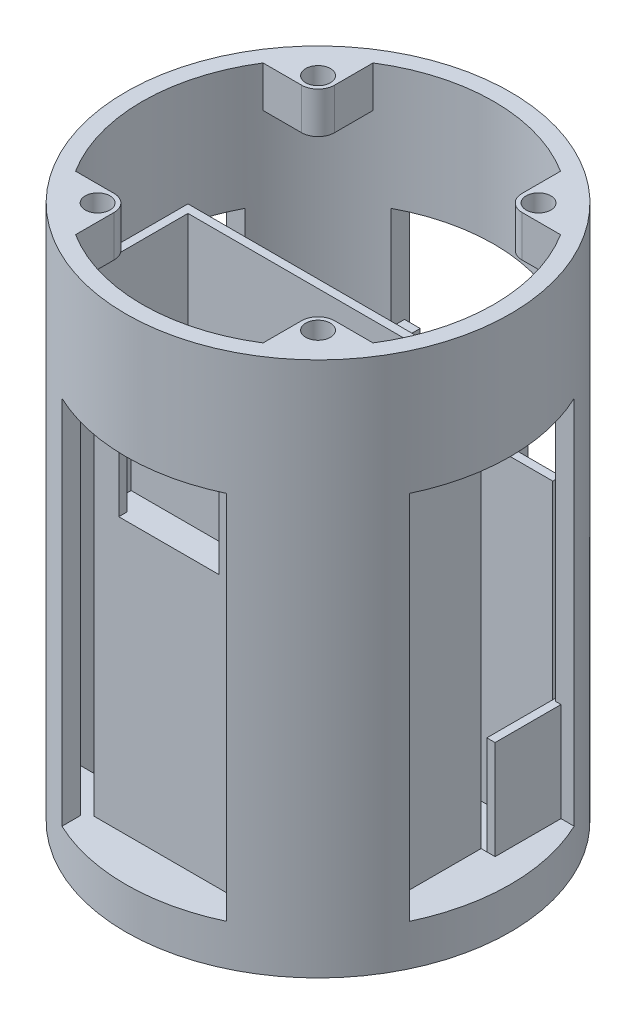
from build123d import *

# Parameters (mm, degrees)
ESQUISSE1_R                  = 23.35
BOSS_EXTRU_1_DEPTH           = 5
ESQUISSE2_W                  = 37
ESQUISSE2_H                  = 8
ESQUISSE2_W_2                = 33.6
ESQUISSE2_H_2                = 14.6
ENL_V_MAT_EXTRU_4_DEPTH      = 3
ESQUISSE10_R                 = 23.35
BOSS_EXTRU_2_DEPTH           = 60
ENL_V_MAT_EXTRU_5_DEPTH      = 73.90709842
ENL_V_MAT_EXTRU_5_DEPTH_BACK = 73.90709842
ESQUISSE11_W                 = 20
ESQUISSE11_H                 = 45
ENL_V_MAT_EXTRU_6_DEPTH      = 73.90709842
ENL_V_MAT_EXTRU_6_DEPTH_BACK = 73.90709842
ESQUISSE12_W                 = 20
ESQUISSE12_H                 = 45
ESQUISSE13_W                 = 18.2
ESQUISSE13_H                 = 4.5
ESQUISSE13_W_2               = 16.2
ESQUISSE13_H_2               = 2.5
BOSS_EXTRU_4_DEPTH           = 50
ENL_V_MAT_EXTRU_7_DEPTH      = 65.151734193
ENL_V_MAT_EXTRU_7_DEPTH_BACK = 17
ESQUISSE16_W                 = 15
ESQUISSE16_H                 = 5
BOSS_EXTRU_5_DEPTH           = 20
BOSS_EXTRU_6_DEPTH           = 15
BOSS_EXTRU_7_START           = -5
ESQUISSE18_R                 = 1.5
BOSS_EXTRU_7_DEPTH           = 5
BOSS_EXTRU_8_DEPTH           = 12
BOSS_EXTRU_9_DEPTH           = 23


with BuildPart() as part:
    # Esquisse1 → Boss.-Extru.1 (new body)
    with BuildSketch(Plane(origin=(0, 0, 0), x_dir=(1, 0, 0), z_dir=(0, 1, 0))):
        with Locations(Location((0, 0, 0), (0, 0, 270))):
            Circle(ESQUISSE1_R)
    extrude(amount=BOSS_EXTRU_1_DEPTH)

    # Esquisse2 → Enlèv. mat.-Extru.4 (cut)
    with BuildSketch(Plane(origin=(0, 5, 0), x_dir=(1, 0, 0), z_dir=(0, 1, 0))):
        with Locations((0, 6)):
            Rectangle(ESQUISSE2_W, ESQUISSE2_H)
        with Locations((0, -6.3)):
            Rectangle(ESQUISSE2_W_2, ESQUISSE2_H_2)
    extrude(amount=-ENL_V_MAT_EXTRU_4_DEPTH, mode=Mode.SUBTRACT)

    # Esquisse10 → Boss.-Extru.2 (add)
    with BuildSketch(Plane(origin=(0, 5, 0), x_dir=(1, 0, 0), z_dir=(0, 1, 0))):
        with Locations(Location((0, 0, 0), (0, 0, 270))):
            Circle(ESQUISSE10_R)
        with BuildLine():
            ThreePointArc((-16.8, -13.175071157), (-6.969307713, 20.180467041), (21.35, 0))
            ThreePointArc((21.35, 0), (20.180467041, -6.969307713), (16.8, -13.175071157))
            Line((16.8, -13.175071157), (16.8, -13.6))
            Line((16.8, -13.6), (16.457900838, -13.6))
            ThreePointArc((16.457900838, -13.6), (0, -21.35), (-16.457900838, -13.6))
            Line((-16.457900838, -13.6), (-16.8, -13.6))
            Line((-16.8, -13.6), (-16.8, -13.175071157))
        make_face(mode=Mode.SUBTRACT)
    extrude(amount=BOSS_EXTRU_2_DEPTH)

    # Esquisse11 → Enlèv. mat.-Extru.5 (cut, two sides: drawn at the far end of the back side and taken through both)
    with BuildSketch(Plane.XY.offset(-ENL_V_MAT_EXTRU_5_DEPTH_BACK)):
        with Locations((0, 27.5)):
            Rectangle(ESQUISSE11_W, ESQUISSE11_H)
    extrude(amount=ENL_V_MAT_EXTRU_5_DEPTH + ENL_V_MAT_EXTRU_5_DEPTH_BACK, mode=Mode.SUBTRACT)

    # Esquisse12 → Enlèv. mat.-Extru.6 (cut, two sides: drawn at the far end of the back side and taken through both)
    with BuildSketch(Plane(origin=(0, 0, 0), x_dir=(0, 0, -1), z_dir=(1, 0, 0)).offset(-ENL_V_MAT_EXTRU_6_DEPTH_BACK)):
        with Locations((0, 27.5)):
            Rectangle(ESQUISSE12_W, ESQUISSE12_H)
    extrude(amount=ENL_V_MAT_EXTRU_6_DEPTH + ENL_V_MAT_EXTRU_6_DEPTH_BACK, mode=Mode.SUBTRACT)

    # Esquisse13 → Boss.-Extru.4 (add)
    # profile 1 of 3: a face of its own
    with BuildSketch(Plane(origin=(0, 5, 0), x_dir=(1, 0, 0), z_dir=(0, 1, 0))):
        with BuildLine():
            Line((17.8, 2), (-17.8, 2))
            Line((-17.8, 2), (-17.8, -11.789083934))
            ThreePointArc((-17.8, -11.789083934), (-17.31387421, -12.49208789), (-16.8, -13.175071157))
            Line((-16.8, -13.175071157), (-16.8, 1))
            Line((-16.8, 1), (16.8, 1))
            Line((16.8, 1), (16.8, -13.175071157))
            ThreePointArc((16.8, -13.175071157), (17.31387421, -12.49208789), (17.8, -11.789083934))
            Line((17.8, -11.789083934), (17.8, 2))
        make_face()
    # profile 2 of 3: a face of its own
    with BuildSketch(Plane(origin=(0, 5, 0), x_dir=(1, 0, 0), z_dir=(0, 1, 0))):
        with Locations((0, -15.85)):
            Rectangle(ESQUISSE13_W, ESQUISSE13_H)
        with Locations((0, -15.85)):
            Rectangle(ESQUISSE13_W_2, ESQUISSE13_H_2, mode=Mode.SUBTRACT)
    # profile 3 of 3: a face of its own
    with BuildSketch(Plane(origin=(0, 5, 0), x_dir=(1, 0, 0), z_dir=(0, 1, 0))):
        with Locations((0, -15.85)):
            Rectangle(ESQUISSE13_W_2, ESQUISSE13_H_2)
    extrude(amount=BOSS_EXTRU_4_DEPTH)

    # Esquisse15 → Enlèv. mat.-Extru.7 (cut, two sides: drawn at the far end of the back side and taken through both)
    with BuildSketch(Plane(origin=(0, 55, 0), x_dir=(1, 0, 0), z_dir=(0, 1, 0)).offset(-ENL_V_MAT_EXTRU_7_DEPTH_BACK)):
        Polygon((8.1, -14.6), (-8.1, -14.6), (-8.1, -17.1), (-6.1, -17.1), (-6.1, -18.1), (6.1, -18.1), (6.1, -17.1), (8.1, -17.1), align=None)
    extrude(amount=ENL_V_MAT_EXTRU_7_DEPTH + ENL_V_MAT_EXTRU_7_DEPTH_BACK, mode=Mode.SUBTRACT)

    # Esquisse16 → Boss.-Extru.5 (add)
    with BuildSketch(Plane(origin=(0, 5, 0), x_dir=(1, 0, 0), z_dir=(0, 1, 0))):
        with Locations((0, 15.5)):
            Rectangle(ESQUISSE16_W, ESQUISSE16_H)
    extrude(amount=BOSS_EXTRU_5_DEPTH)

    # Esquisse17 → Boss.-Extru.6 (add)
    with BuildSketch(Plane(origin=(0, 25, 0), x_dir=(1, 0, 0), z_dir=(0, 1, 0))):
        Polygon((7.5, 18), (-0.6, 18), (-0.6, 17), (5.6, 17), (5.6, 14), (-5.6, 14), (-5.6, 16.758406292), (-5.6, 18), (-7.5, 18), (-7.5, 13), (7.5, 13), align=None)
    extrude(amount=BOSS_EXTRU_6_DEPTH)

    # Esquisse18 → Boss.-Extru.7 (add)
    # profile 1 of 4: a face of its own
    with BuildSketch(Plane(origin=(0, 65, 0), x_dir=(1, 0, 0), z_dir=(0, 1, 0)).offset(BOSS_EXTRU_7_START)):
        with BuildLine():
            Line((-11.385882097, 13.385882097), (-11.385882097, 20.385882097))
            ThreePointArc((-11.385882097, 20.385882097), (-16.510943341, 16.510943341), (-20.385882097, 11.385882097))
            Line((-20.385882097, 11.385882097), (-13.385882097, 11.385882097))
            ThreePointArc((-13.385882097, 11.385882097), (-11.971668535, 11.971668535), (-11.385882097, 13.385882097))
        make_face()
        with Locations(Location((-13.385882097, 13.385882097, 0), (0, 0, 270))):
            Circle(ESQUISSE18_R, mode=Mode.SUBTRACT)
    # profile 2 of 4: a face of its own
    with BuildSketch(Plane(origin=(0, 65, 0), x_dir=(1, 0, 0), z_dir=(0, 1, 0)).offset(BOSS_EXTRU_7_START)):
        with BuildLine():
            ThreePointArc((20.385882097, 11.385882097), (16.510943341, 16.510943341), (11.385882097, 20.385882097))
            Line((11.385882097, 20.385882097), (11.385882097, 13.385882097))
            ThreePointArc((11.385882097, 13.385882097), (11.971668535, 11.971668535), (13.385882097, 11.385882097))
            Line((13.385882097, 11.385882097), (20.385882097, 11.385882097))
        make_face()
        with Locations(Location((13.385882097, 13.385882097, 0), (0, 0, 270))):
            Circle(ESQUISSE18_R, mode=Mode.SUBTRACT)
    # profile 3 of 4: a face of its own
    with BuildSketch(Plane(origin=(0, 65, 0), x_dir=(1, 0, 0), z_dir=(0, 1, 0)).offset(BOSS_EXTRU_7_START)):
        with BuildLine():
            Line((-13.385882097, -11.385882097), (-20.385882097, -11.385882097))
            ThreePointArc((-20.385882097, -11.385882097), (-16.510943341, -16.510943341), (-11.385882097, -20.385882097))
            Line((-11.385882097, -20.385882097), (-11.385882097, -13.385882097))
            ThreePointArc((-11.385882097, -13.385882097), (-11.971668535, -11.971668535), (-13.385882097, -11.385882097))
        make_face()
        with Locations(Location((-13.385882097, -13.385882097, 0), (0, 0, 270))):
            Circle(ESQUISSE18_R, mode=Mode.SUBTRACT)
    # profile 4 of 4: a face of its own
    with BuildSketch(Plane(origin=(0, 65, 0), x_dir=(1, 0, 0), z_dir=(0, 1, 0)).offset(BOSS_EXTRU_7_START)):
        with BuildLine():
            ThreePointArc((11.385882097, -20.385882097), (16.510943341, -16.510943341), (20.385882097, -11.385882097))
            Line((20.385882097, -11.385882097), (13.385882097, -11.385882097))
            ThreePointArc((13.385882097, -11.385882097), (11.971668535, -11.971668535), (11.385882097, -13.385882097))
            Line((11.385882097, -13.385882097), (11.385882097, -20.385882097))
        make_face()
        with Locations(Location((13.385882097, -13.385882097, 0), (0, 0, 270))):
            Circle(ESQUISSE18_R, mode=Mode.SUBTRACT)
    extrude(amount=BOSS_EXTRU_7_DEPTH)

    # Esquisse33 → Boss.-Extru.8 (add)
    with BuildSketch(Plane(origin=(0, 5, 0), x_dir=(1, 0, 0), z_dir=(0, 1, 0))):
        with BuildLine():
            Line((-19.5, 2), (-18.5, 2))
            Line((-18.5, 2), (-18.5, 10))
            Line((-18.5, 10), (18.5, 10))
            Line((18.5, 10), (18.5, 2))
            Line((18.5, 2), (19.5, 2))
            Line((19.5, 2), (19.5, 8.693244504))
            Line((19.5, 8.693244504), (19.5, 10))
            Line((19.5, 10), (18.863257937, 10))
            ThreePointArc((18.863257937, 10), (18.587432982, 10.503800986), (18.298155645, 11))
            Line((18.298155645, 11), (18.128988944, 11))
            Line((18.128988944, 11), (-18.298155645, 11))
            ThreePointArc((-18.298155645, 11), (-18.587432982, 10.503800986), (-18.863257937, 10))
            Line((-18.863257937, 10), (-19.5, 10))
            Line((-19.5, 10), (-19.5, 8.693244504))
            Line((-19.5, 8.693244504), (-19.5, 2))
        make_face()
    extrude(amount=BOSS_EXTRU_8_DEPTH)

    # Esquisse34 → Boss.-Extru.9 (add)
    with BuildSketch(Plane(origin=(0, 17, 0), x_dir=(1, 0, 0), z_dir=(0, 1, 0))):
        with BuildLine():
            Line((-18.5, 10), (18.5, 10))
            Line((18.5, 10), (18.5, 10.657039927))
            ThreePointArc((18.5, 10.657039927), (18.399876905, 10.828990252), (18.298155645, 11))
            Line((18.298155645, 11), (-18.298155645, 11))
            ThreePointArc((-18.298155645, 11), (-18.587432982, 10.503800986), (-18.863257937, 10))
            Line((-18.863257937, 10), (-19.5, 10))
            Line((-19.5, 10), (-19.5, 2))
            Line((-19.5, 2), (-18.5, 2))
            Line((-18.5, 2), (-18.5, 10))
        make_face()
    extrude(amount=BOSS_EXTRU_9_DEPTH)


solid = part.part
